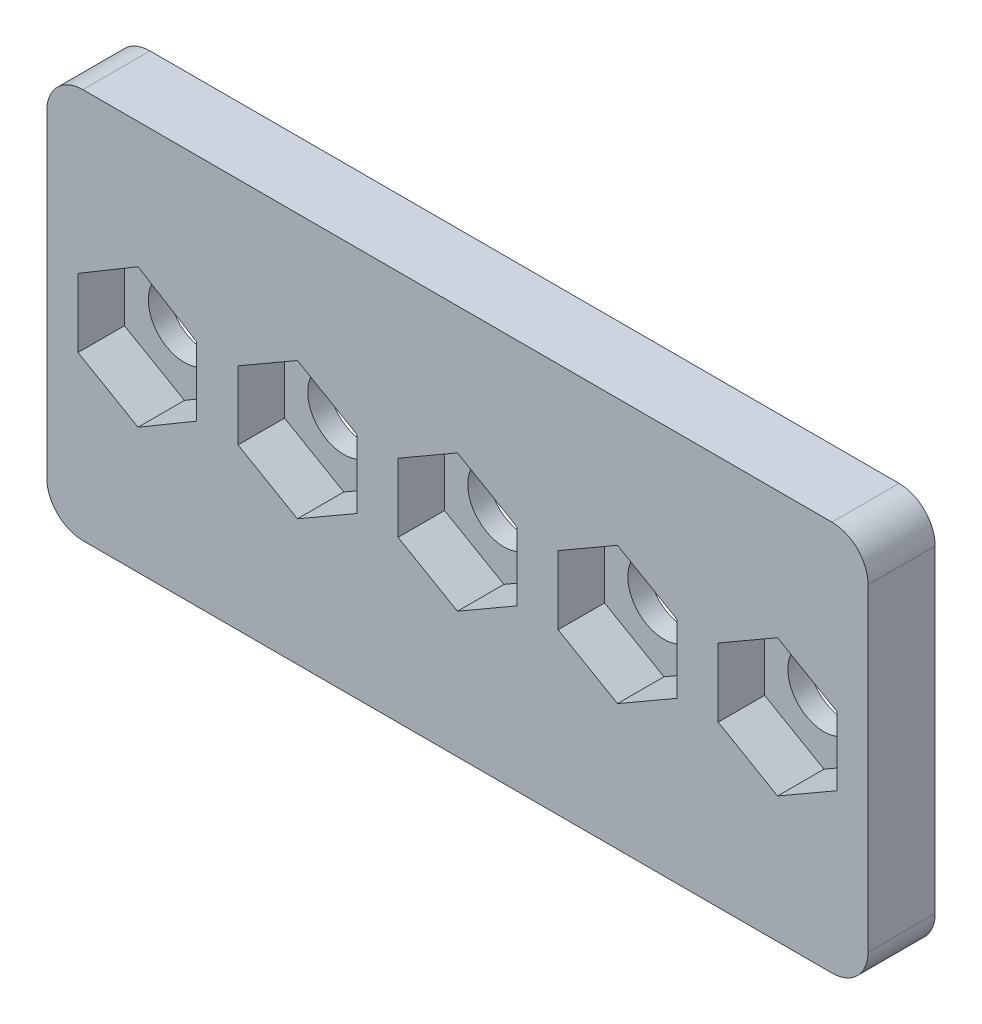
from build123d import *

# Parameters (mm, degrees)
SKETCH3_W           = 79.545894585
SKETCH3_H           = 37.823430605
SKETCH3_R           = 3.5
BOSS_EXTRUDE2_DEPTH = 6.5
SKETCH3_3_R         = 3.5
CUT_EXTRUDE2_DEPTH  = 4.5
FILLET1_R           = 3.5


with BuildPart() as part:
    # Sketch3 → Boss-Extrude2 (new body)
    with BuildSketch(Plane.XY.offset(6.8)):
        with Locations((-2.629280553, 6.684087798)):
            Rectangle(SKETCH3_W, SKETCH3_H)
        with Locations((-33.566454678, 6.627672505)):
            Circle(SKETCH3_R, mode=Mode.SUBTRACT)
        with Locations((28.370719447, 6.627672505)):
            Circle(SKETCH3_R, mode=Mode.SUBTRACT)
        with Locations((12.870719447, 6.627672505)):
            Circle(SKETCH3_R, mode=Mode.SUBTRACT)
        with Locations((-2.629280553, 6.627672505)):
            Circle(SKETCH3_R, mode=Mode.SUBTRACT)
        with Locations((-18.129280553, 6.627672505)):
            Circle(SKETCH3_R, mode=Mode.SUBTRACT)
    extrude(amount=-BOSS_EXTRUDE2_DEPTH)

    # Sketch3<3> → Cut-Extrude2 (cut)
    # profile 1 of 5: a face of its own
    with BuildSketch(Plane.XY.offset(6.8)):
        Polygon((-27.879280553, 9.947436553), (-33.566454678, 13.416303721), (-39.379280553, 9.947436553), (-39.379280553, 3.307908457), (-33.566454678, -0.048128126), (-27.879280553, 3.307908457), (-27.879280553, 6.627672505), align=None)
        with Locations((-33.566454678, 6.627672505)):
            Circle(SKETCH3_3_R, mode=Mode.SUBTRACT)
    # profile 2 of 5: a face of its own
    with BuildSketch(Plane.XY.offset(6.8)):
        Polygon((-23.879280553, 9.947436553), (-23.879280553, 3.307908457), (-18.129280553, -0.01185559), (-12.379280553, 3.307908457), (-12.379280553, 9.947436553), (-18.129280553, 13.267200601), align=None)
        with Locations((-18.129280553, 6.627672505)):
            Circle(SKETCH3_3_R, mode=Mode.SUBTRACT)
    # profile 3 of 5: a face of its own
    with BuildSketch(Plane.XY.offset(6.8)):
        Polygon((34.120719447, 3.307908457), (34.120719447, 9.947436553), (28.370719447, 13.267200601), (22.620719447, 9.947436553), (22.620719447, 6.627672505), (22.620719447, 3.307908457), (28.370719447, -0.01185559), align=None)
        with Locations((28.370719447, 6.627672505)):
            Circle(SKETCH3_3_R, mode=Mode.SUBTRACT)
    # profile 4 of 5: a face of its own
    with BuildSketch(Plane.XY.offset(6.8)):
        Polygon((-8.379280553, 9.947436553), (-8.379280553, 3.307908457), (-2.629280553, -0.01185559), (3.120719447, 3.307908457), (3.120719447, 9.947436553), (-2.629280553, 13.267200601), align=None)
        with Locations((-2.629280553, 6.627672505)):
            Circle(SKETCH3_3_R, mode=Mode.SUBTRACT)
    # profile 5 of 5: a face of its own
    with BuildSketch(Plane.XY.offset(6.8)):
        Polygon((18.620719447, 3.307908457), (18.620719447, 9.947436553), (12.870719447, 13.267200601), (7.120719447, 9.947436553), (7.120719447, 3.307908457), (12.870719447, -0.01185559), align=None)
        with Locations((12.870719447, 6.627672505)):
            Circle(SKETCH3_3_R, mode=Mode.SUBTRACT)
    extrude(amount=-CUT_EXTRUDE2_DEPTH, mode=Mode.SUBTRACT)

    # Fillet1
    fillet1_edges = [part.edges().sort_by_distance(p)[0] for p in [
        (-42.402227845, 25.5958031, 3.55),
        (-42.402227845, -12.227627505, 3.55),
        (37.14366674, 25.5958031, 3.55),
        (37.14366674, -12.227627505, 3.55),
    ]]
    fillet(fillet1_edges, radius=FILLET1_R)


solid = part.part
